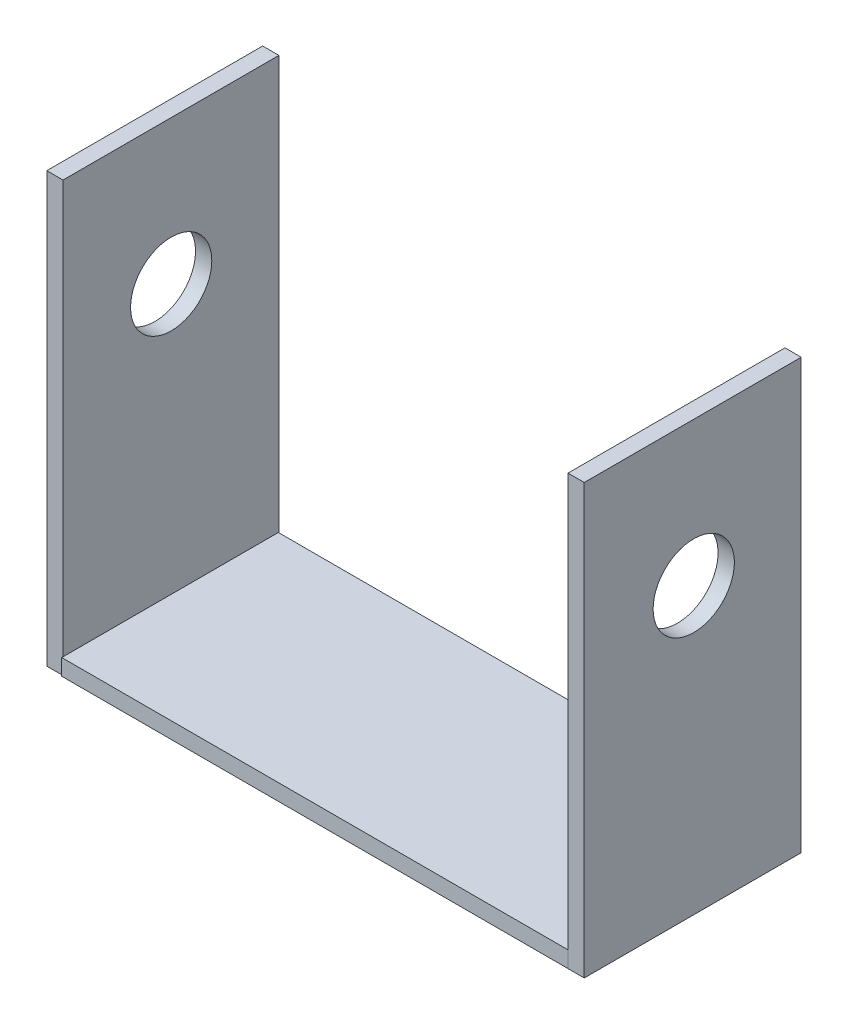
from build123d import *

# Parameters (mm, degrees)
SKETCH1_W           = 47.5234
SKETCH1_H           = 20.32
BOSS_EXTRUDE1_DEPTH = 1.524
SKETCH2_W           = 20.254011441
SKETCH2_H           = 40.259
BOSS_EXTRUDE2_DEPTH = 1.524
SKETCH3_W           = 20.355556003
SKETCH3_H           = 40.259
BOSS_EXTRUDE3_DEPTH = 1.524
SKETCH5_R           = 3.81
CUT_EXTRUDE1_DEPTH  = 66.421937049


with BuildPart() as part:
    # Sketch1 → Boss-Extrude1 (new body)
    with BuildSketch(Plane(origin=(0, 0, 0), x_dir=(1, 0, 0), z_dir=(0, 1, 0))):
        Rectangle(SKETCH1_W, SKETCH1_H)
    extrude(amount=BOSS_EXTRUDE1_DEPTH)

    # Sketch2 → Boss-Extrude2 (add)
    with BuildSketch(Plane(origin=(-23.749, 0, 0), x_dir=(0, 0, -1), z_dir=(1, 0, 0))):
        with Locations((0.087917198, 20.1295)):
            Rectangle(SKETCH2_W, SKETCH2_H)
    extrude(amount=-BOSS_EXTRUDE2_DEPTH)

    # Sketch3 → Boss-Extrude3 (add)
    with BuildSketch(Plane(origin=(23.749, 0, 0), x_dir=(0, 0, -1), z_dir=(1, 0, 0))):
        with Locations((0.014847815, 20.1295)):
            Rectangle(SKETCH3_W, SKETCH3_H)
    extrude(amount=BOSS_EXTRUDE3_DEPTH)

    # Sketch5 → Cut-Extrude1 (cut, through all)
    with BuildSketch(Plane.ZY.offset(25.273)):
        with Locations((-0.107211081, 26.738775407)):
            Circle(SKETCH5_R)
    extrude(amount=-CUT_EXTRUDE1_DEPTH, mode=Mode.SUBTRACT)


solid = part.part
